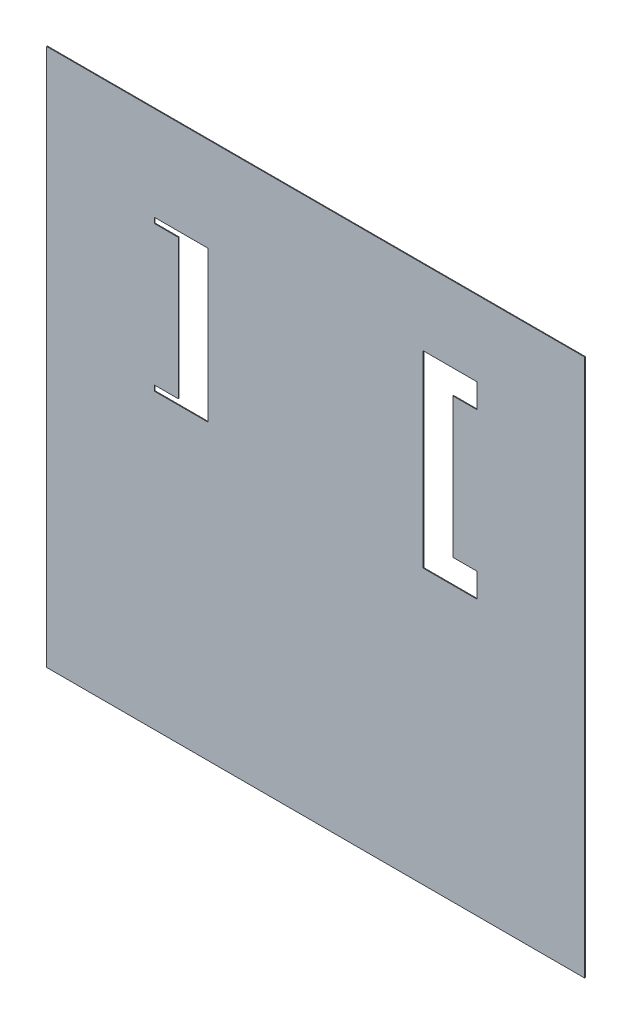
from build123d import *

# Parameters (mm, degrees)
SKETCH1_W           = 25.4
SKETCH1_H           = 25.4
BOSS_EXTRUDE1_DEPTH = 0.03556
CUT_EXTRUDE1_DEPTH  = 36.921042086


with BuildPart() as part:
    # Sketch1 → Boss-Extrude1 (new body)
    with BuildSketch(Plane.XY):
        with Locations((12.7, 12.7)):
            Rectangle(SKETCH1_W, SKETCH1_H)
    extrude(amount=BOSS_EXTRUDE1_DEPTH)

    # Sketch2 → Cut-Extrude1 (cut, through all)
    with BuildSketch(Plane.XY.offset(0.03556)):
        Polygon((5.08, 20.955), (7.62, 20.955), (7.62, 13.843), (5.08, 13.843), (5.08, 14.097), (6.223, 14.097), (6.223, 20.701), (5.08, 20.701), align=None)
        Polygon((17.78, 21.844), (20.32, 21.844), (20.32, 20.701), (19.177, 20.701), (19.177, 14.097), (20.32, 14.097), (20.32, 12.954), (17.78, 12.954), align=None)
    extrude(amount=-CUT_EXTRUDE1_DEPTH, mode=Mode.SUBTRACT)


solid = part.part
